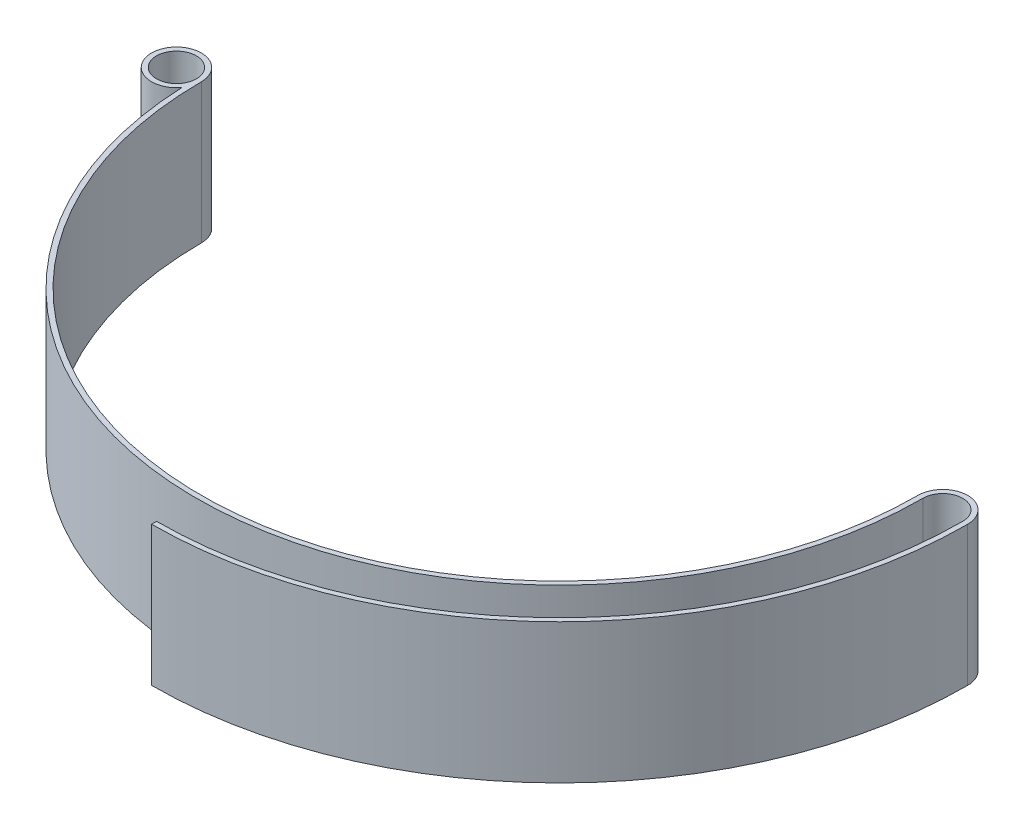
from build123d import *

# Parameters (mm, degrees)
SKETCH1_R           = 4
BOSS_EXTRUDE1_DEPTH = 28


with BuildPart() as part:
    # Sketch1 → Boss-Extrude1 (new body)
    with BuildSketch(Plane(origin=(0, 0, 0), x_dir=(1, 0, 0), z_dir=(0, 1, 0))):
        with BuildLine():
            Line((76.845, -80.845), (76.845, -81.845))
            ThreePointArc((76.845, -81.845), (134.718154506, -57.873154506), (158.69, 0))
            ThreePointArc((158.69, 0), (153.69, 5), (148.69, 0))
            ThreePointArc((148.69, 0), (76.845, -71.845), (5, 0))
            ThreePointArc((5, 0), (-4.758823236, 1.534145171), (4.058559438, -2.920290275))
            ThreePointArc((4.058559438, -2.920290275), (78.305438675, -72.830358669), (149.69, 0))
            ThreePointArc((149.69, 0), (153.69, 4), (157.69, 0))
            ThreePointArc((157.69, 0), (134.011047725, -57.166047725), (76.845, -80.845))
        make_face()
        with Locations(Location((0, 0, 0), (0, 0, 270))):
            Circle(SKETCH1_R, mode=Mode.SUBTRACT)
    extrude(amount=BOSS_EXTRUDE1_DEPTH)


solid = part.part
